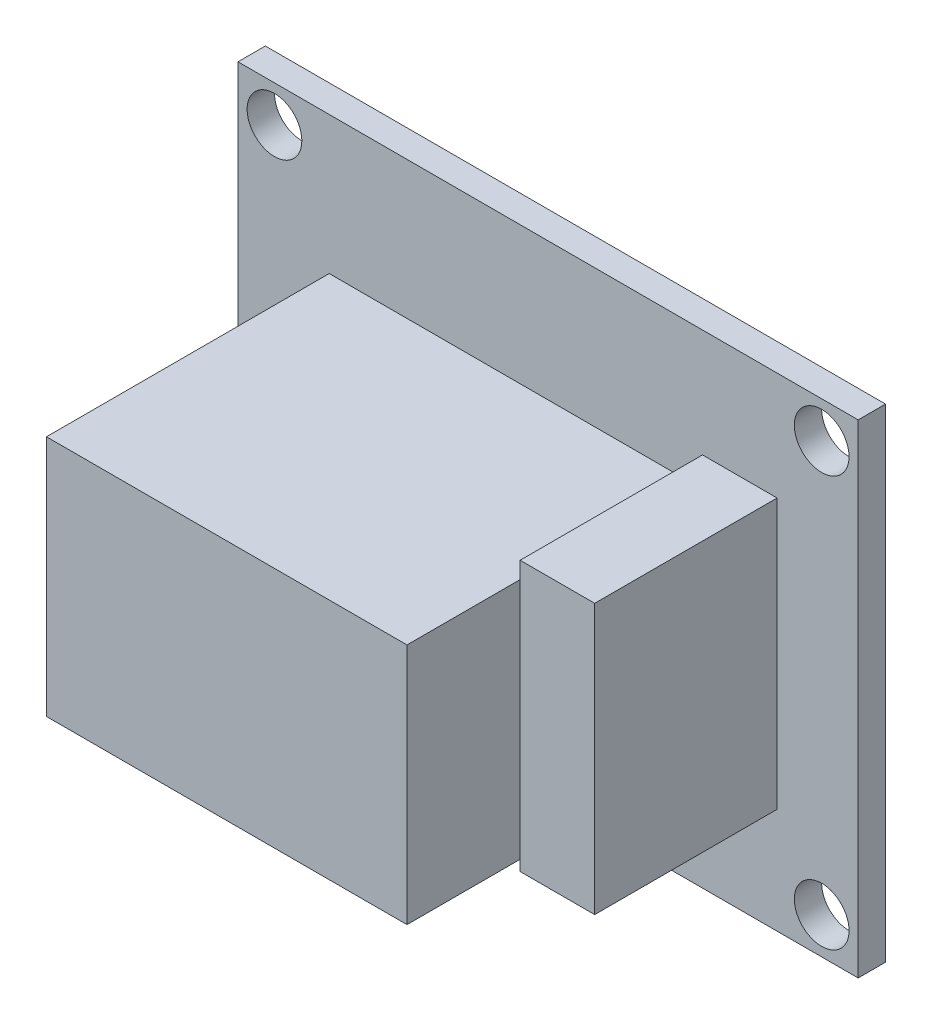
from build123d import *

# Parameters (mm, degrees)
SKETCH1_W           = 34
SKETCH1_H           = 26.5
SKETCH1_R           = 1.5
BOSS_EXTRUDE1_DEPTH = 1.5
SKETCH2_W           = 19.764821035
SKETCH2_H           = 13.28137913
BOSS_EXTRUDE2_DEPTH = 15.5
SKETCH3_W           = 4.088439113
SKETCH3_H           = 14.781279869
BOSS_EXTRUDE3_DEPTH = 10


with BuildPart() as part:
    # Sketch1 → Boss-Extrude1 (new body)
    with BuildSketch(Plane.XY):
        with Locations((17, 13.25)):
            Rectangle(SKETCH1_W, SKETCH1_H)
        with Locations((2, 24.5)):
            Circle(SKETCH1_R, mode=Mode.SUBTRACT)
        with Locations((32, 24.5)):
            Circle(SKETCH1_R, mode=Mode.SUBTRACT)
        with Locations((2, 2)):
            Circle(SKETCH1_R, mode=Mode.SUBTRACT)
        with Locations((32, 2)):
            Circle(SKETCH1_R, mode=Mode.SUBTRACT)
    extrude(amount=BOSS_EXTRUDE1_DEPTH)

    # Sketch2 → Boss-Extrude2 (add)
    with BuildSketch(Plane.XY.offset(1.5)):
        with Locations((14.883204602, 12.306514051)):
            Rectangle(SKETCH2_W, SKETCH2_H)
    extrude(amount=BOSS_EXTRUDE2_DEPTH)

    # Sketch3 → Boss-Extrude3 (add)
    with BuildSketch(Plane.XY.offset(1.5)):
        with Locations((27.511401151, 13.177424158)):
            Rectangle(SKETCH3_W, SKETCH3_H)
    extrude(amount=BOSS_EXTRUDE3_DEPTH)


solid = part.part
